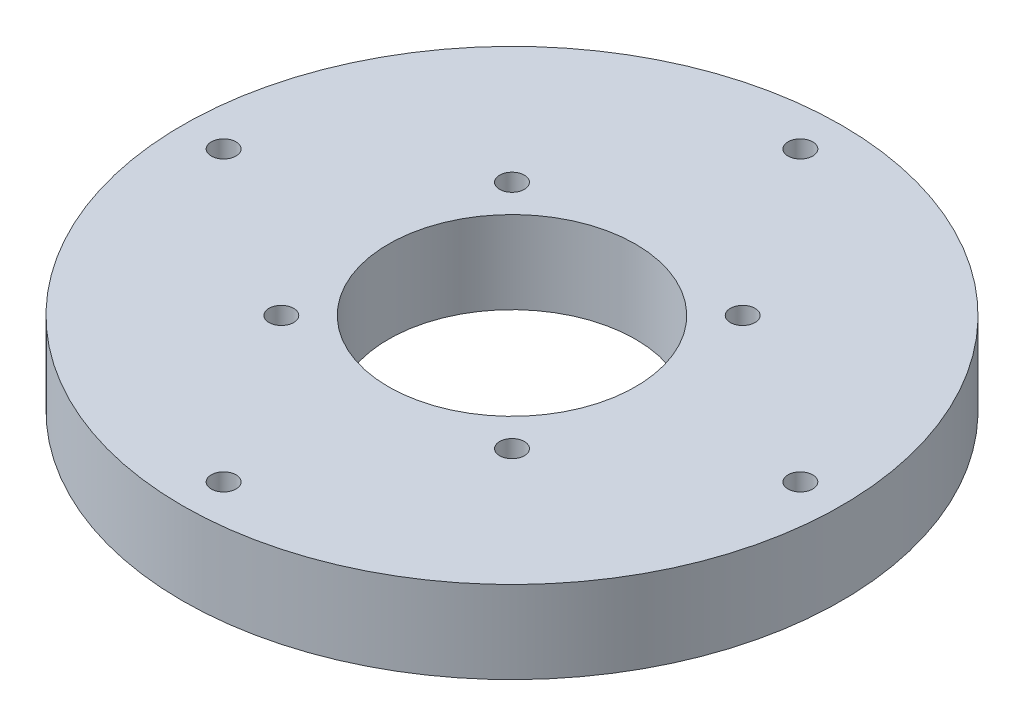
from build123d import *

# Parameters (mm, degrees)
SKETCH_1_W          = 50
SKETCH_1_H          = 50
SKETCH_1_R          = 7.5
EXTRUDE_1_DEPTH     = 5
SKETCH_3_R          = 0.75
CUT_EXTRUDE_2_DEPTH = 36.707142143
SKETCH_4_R          = 0.75
CUT_EXTRUDE_3_DEPTH = 36.707142143
SKETCH_5_OUTSIDE_W  = 66.178
SKETCH_5_OUTSIDE_H  = 66.178
SKETCH_5_OUTSIDE_R  = 20
CUT_EXTRUDE_4_DEPTH = 36.707142143


with BuildPart() as part:
    # 草图1 → 凸台-拉伸1 (new body)
    with BuildSketch(Plane(origin=(0, 0, 0), x_dir=(1, 0, 0), z_dir=(0, 1, 0))):
        Rectangle(SKETCH_1_W, SKETCH_1_H)
        with Locations(Location((0, 0, 0), (0, 0, 270))):
            Circle(SKETCH_1_R, mode=Mode.SUBTRACT)
    extrude(amount=EXTRUDE_1_DEPTH)

    # 草图3 → 切除-拉伸2 (cut, through all)
    with BuildSketch(Plane.XZ):
        with Locations(Location((-7, 7, 0), (0, 0, 270))):
            Circle(SKETCH_3_R)
        with Locations(Location((7, 7, 0), (0, 0, 270))):
            Circle(SKETCH_3_R)
        with Locations(Location((7, -7, 0), (0, 0, 270))):
            Circle(SKETCH_3_R)
        with Locations(Location((-7, -7, 0), (0, 0, 270))):
            Circle(SKETCH_3_R)
    extrude(amount=-CUT_EXTRUDE_2_DEPTH, mode=Mode.SUBTRACT)

    # 草图4 → 切除-拉伸3 (cut, through all)
    with BuildSketch(Plane(origin=(0, 5, 0), x_dir=(1, 0, 0), z_dir=(0, 1, 0))):
        with Locations(Location((0, -17.5, 0), (0, 0, 270))):
            Circle(SKETCH_4_R)
        with Locations(Location((0, 17.5, 0), (0, 0, 270))):
            Circle(SKETCH_4_R)
        with Locations(Location((17.5, 0, 0), (0, 0, 270))):
            Circle(SKETCH_4_R)
        with Locations(Location((-17.5, 0, 0), (0, 0, 270))):
            Circle(SKETCH_4_R)
    extrude(amount=-CUT_EXTRUDE_3_DEPTH, mode=Mode.SUBTRACT)

    # 草图5 outside → 切除-拉伸4 (cut, through all)
    with BuildSketch(Plane(origin=(0, 5, 0), x_dir=(1, 0, 0), z_dir=(0, 1, 0))):
        Rectangle(SKETCH_5_OUTSIDE_W, SKETCH_5_OUTSIDE_H)
        with Locations(Location((0, 0, 0), (0, 0, 270))):
            Circle(SKETCH_5_OUTSIDE_R, mode=Mode.SUBTRACT)
    extrude(amount=-CUT_EXTRUDE_4_DEPTH, mode=Mode.SUBTRACT)


solid = part.part
